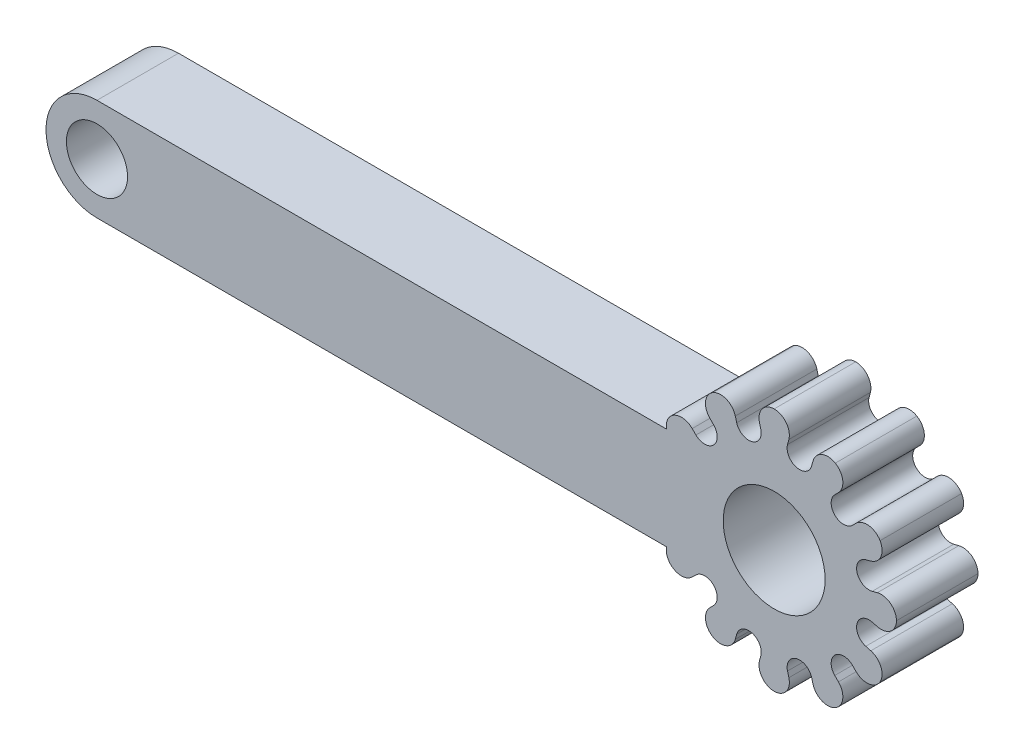
from build123d import *

# Parameters (mm, degrees)
SKETCH1_R           = 1.5
BOSS_EXTRUDE1_DEPTH = 4
CUT_EXTRUDE1_DEPTH  = 23.415528994
CIRPATTERN1_COUNT   = 12
SKETCH3_W           = 11.336678395
SKETCH3_H           = 5
BOSS_EXTRUDE2_DEPTH = 4
SKETCH4_R           = 2.5
CUT_EXTRUDE2_DEPTH  = 23.415528994


with BuildPart() as part:
    # Sketch1 → Boss-Extrude1 (new body)
    with BuildSketch(Plane.XY):
        with BuildLine():
            Line((-18, 2.5), (9.769591268, 2.5))
            ThreePointArc((9.769591268, 2.5), (21.223947325, 0), (9.769591268, -2.5))
            Line((9.769591268, -2.5), (-18, -2.5))
            ThreePointArc((-18, -2.5), (-20.5, 0), (-18, 2.5))
        make_face()
        with Locations((-18, 0)):
            Circle(SKETCH1_R, mode=Mode.SUBTRACT)
    extrude(amount=BOSS_EXTRUDE1_DEPTH)

    # Sketch2 → Cut-Extrude1 (cut, through all)
    with BuildSketch(Plane.XY.offset(4)):
        with BuildLine():
            Line((15.878876805, 4.81), (15.943947325, 5.06))
            ThreePointArc((15.943947325, 5.06), (15.813826986, 5.706078038), (15.223947325, 6))
            ThreePointArc((15.223947325, 6), (16.816567466, 5.943739283), (18.223947325, 5.196152423))
            ThreePointArc((18.223947325, 5.196152423), (17.566135573, 5.236548367), (17.130409034, 4.742088543))
            Line((17.130409034, 4.742088543), (17.061761758, 4.493046932))
            ThreePointArc((17.061761758, 4.493046932), (16.312974518, 4.064304815), (15.878876805, 4.81))
        make_face()
    cut_extrude1 = extrude(amount=-CUT_EXTRUDE1_DEPTH, mode=Mode.SUBTRACT)

    # CirPattern1: Cut-Extrude1 ×12 about axis
    cirpattern1_axis = Axis((15.223947325, 0, 0), (0, 0, 1))
    for i in range(1, CIRPATTERN1_COUNT):
        add(cut_extrude1.rotate(cirpattern1_axis, i * 360 / CIRPATTERN1_COUNT), mode=Mode.SUBTRACT)

    # Sketch3 → Boss-Extrude2 (add)
    with BuildSketch(Plane.XY.offset(4)):
        with Locations((11.656973093, 0)):
            Rectangle(SKETCH3_W, SKETCH3_H)
    extrude(amount=-BOSS_EXTRUDE2_DEPTH)

    # Sketch4 → Cut-Extrude2 (cut, through all)
    with BuildSketch(Plane.XY.offset(4)):
        with Locations((15.223947325, 0)):
            Circle(SKETCH4_R)
    extrude(amount=-CUT_EXTRUDE2_DEPTH, mode=Mode.SUBTRACT)


solid = part.part
